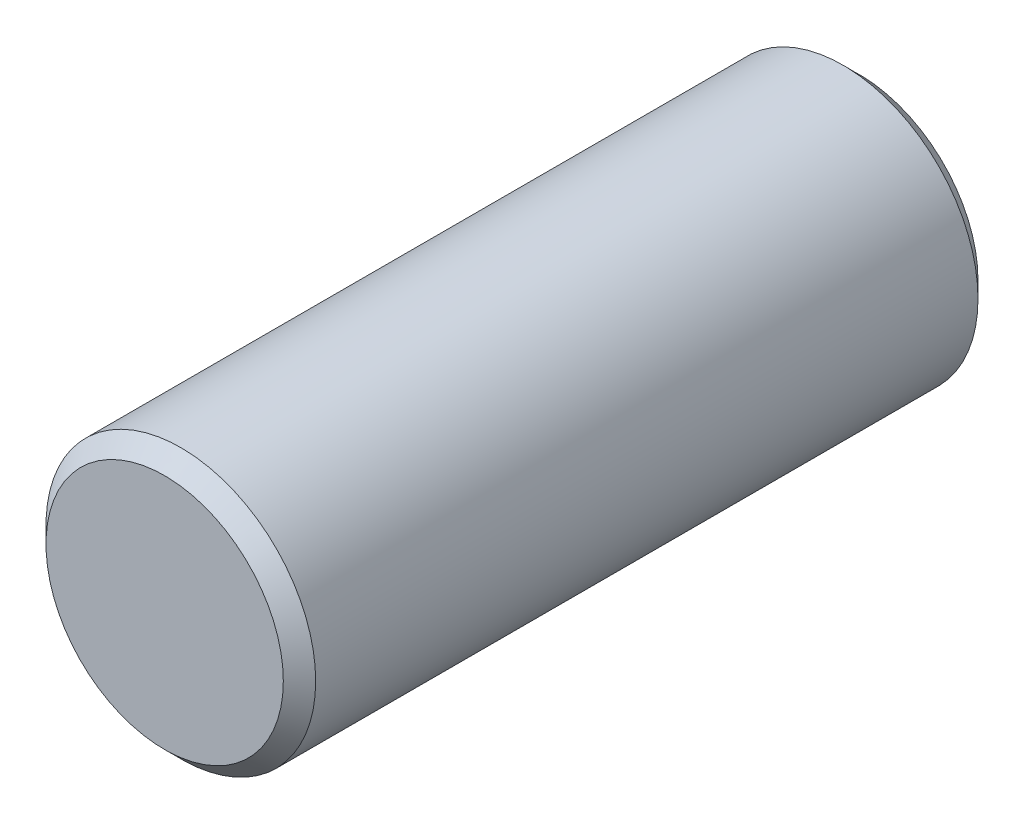
from build123d import *

# Parameters (mm, degrees)
SKETCH2_R      = 3.175
EXTRUDE1_DEPTH = 8.1788
CHAMFER1_SIZE  = 0.381


with BuildPart() as part:
    # Sketch2 → Extrude1 (new, symmetric)
    with BuildSketch(Plane.XY):
        Circle(SKETCH2_R)
    extrude(amount=EXTRUDE1_DEPTH, both=True)

    # Chamfer1
    chamfer1_edges = [part.edges().sort_by_distance(p)[0] for p in [
        (-3.175, 0, -8.1788),
        (-3.175, 0, 8.1788),
    ]]
    chamfer(chamfer1_edges, length=CHAMFER1_SIZE)


solid = part.part
